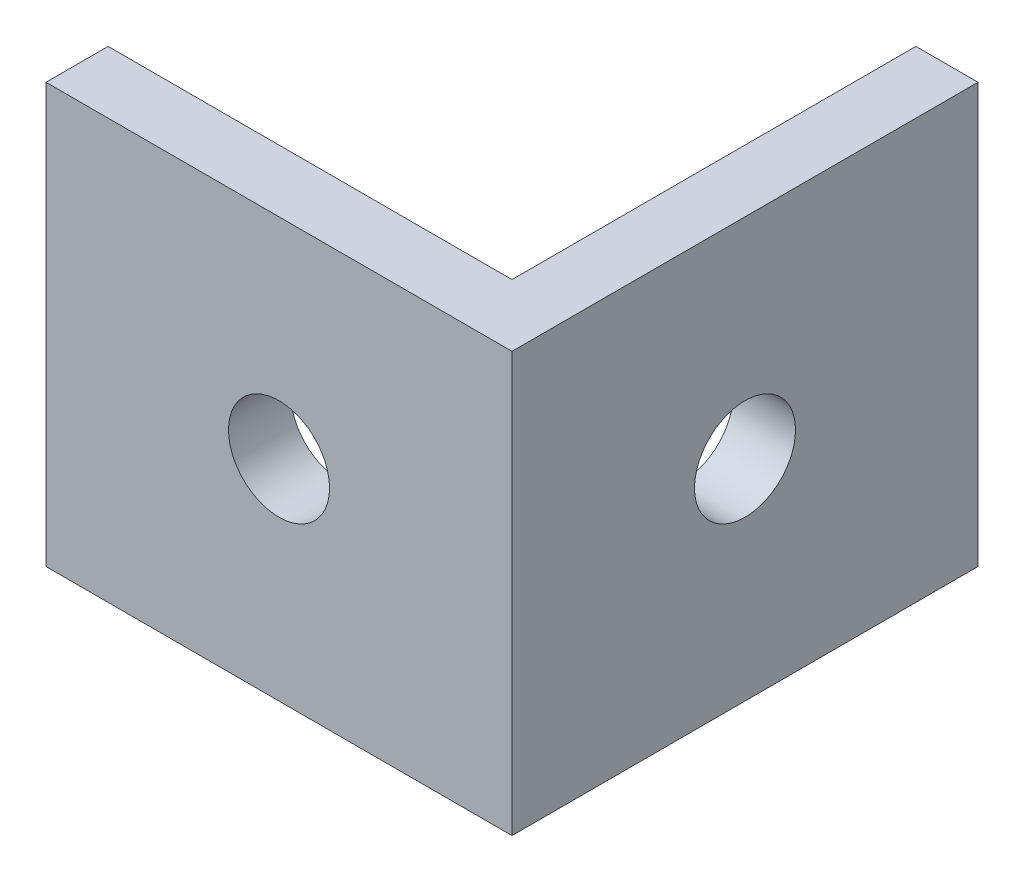
from build123d import *

# Parameters (mm, degrees)
EXTRUDE_1_DEPTH     = 27
SKETCH_2_R          = 3.25
CUT_EXTRUDE_1_DEPTH = 27
SKETCH_3_R          = 3.25
CUT_EXTRUDE_2_DEPTH = 27


with BuildPart() as part:
    # 草图1 → 凸台-拉伸1 (new body)
    with BuildSketch(Plane(origin=(0, 0, 0), x_dir=(1, 0, 0), z_dir=(0, 1, 0))):
        Polygon((0, 0), (0, 30), (-4, 30), (-4, 4), (-30, 4), (-30, 0), align=None)
    extrude(amount=EXTRUDE_1_DEPTH)

    # 草图2 → 切除-拉伸1 (cut)
    with BuildSketch(Plane(origin=(0, 0, -4), x_dir=(-1, 0, 0), z_dir=(0, 0, -1))):
        with Locations((15, 13.5)):
            Circle(SKETCH_2_R)
    extrude(amount=-CUT_EXTRUDE_1_DEPTH, mode=Mode.SUBTRACT)

    # 草图3 → 切除-拉伸2 (cut)
    with BuildSketch(Plane(origin=(0, 0, 0), x_dir=(0, 0, -1), z_dir=(1, 0, 0))):
        with Locations((15, 13.5)):
            Circle(SKETCH_3_R)
    extrude(amount=-CUT_EXTRUDE_2_DEPTH, mode=Mode.SUBTRACT)


solid = part.part
